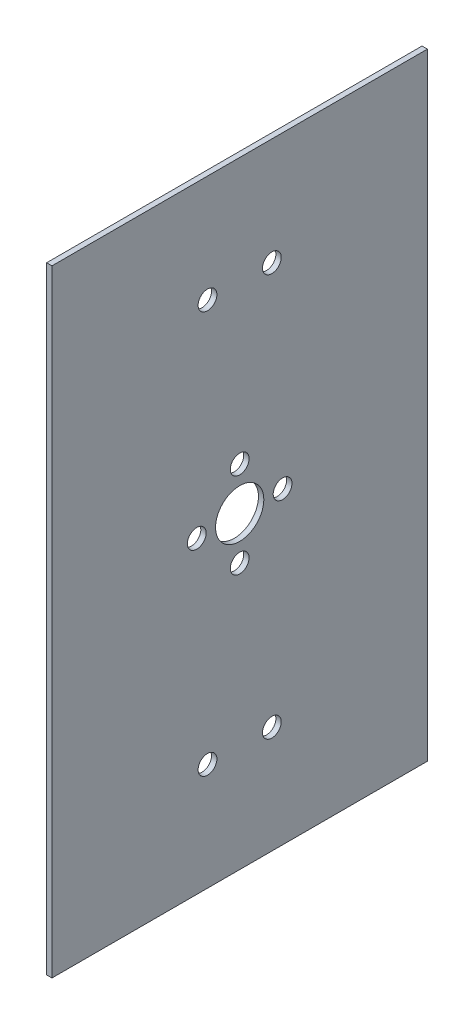
from build123d import *

# Parameters (mm, degrees)
SKETCH1_W           = 70
SKETCH1_H           = 115
SKETCH1_R           = 4.5
SKETCH1_R_2         = 1.75
BOSS_EXTRUDE1_DEPTH = 1


with BuildPart() as part:
    # Sketch1 → Boss-Extrude1 (new body)
    with BuildSketch(Plane(origin=(0, 0, 0), x_dir=(0, 0, -1), z_dir=(1, 0, 0))):
        Rectangle(SKETCH1_W, SKETCH1_H)
        Circle(SKETCH1_R, mode=Mode.SUBTRACT)
        with Locations((0, 8)):
            Circle(SKETCH1_R_2, mode=Mode.SUBTRACT)
        with Locations((8, 0)):
            Circle(SKETCH1_R_2, mode=Mode.SUBTRACT)
        with Locations((0, -8)):
            Circle(SKETCH1_R_2, mode=Mode.SUBTRACT)
        with Locations((-8, 0)):
            Circle(SKETCH1_R_2, mode=Mode.SUBTRACT)
        with Locations((-6, 37.5)):
            Circle(SKETCH1_R_2, mode=Mode.SUBTRACT)
        with Locations(Location((6, 37.5, 0), (0, 0, 180))):
            Circle(SKETCH1_R_2, mode=Mode.SUBTRACT)
        with Locations((6, -37.5)):
            Circle(SKETCH1_R_2, mode=Mode.SUBTRACT)
        with Locations(Location((-6, -37.5, 0), (0, 0, 180))):
            Circle(SKETCH1_R_2, mode=Mode.SUBTRACT)
    extrude(amount=BOSS_EXTRUDE1_DEPTH)


solid = part.part
